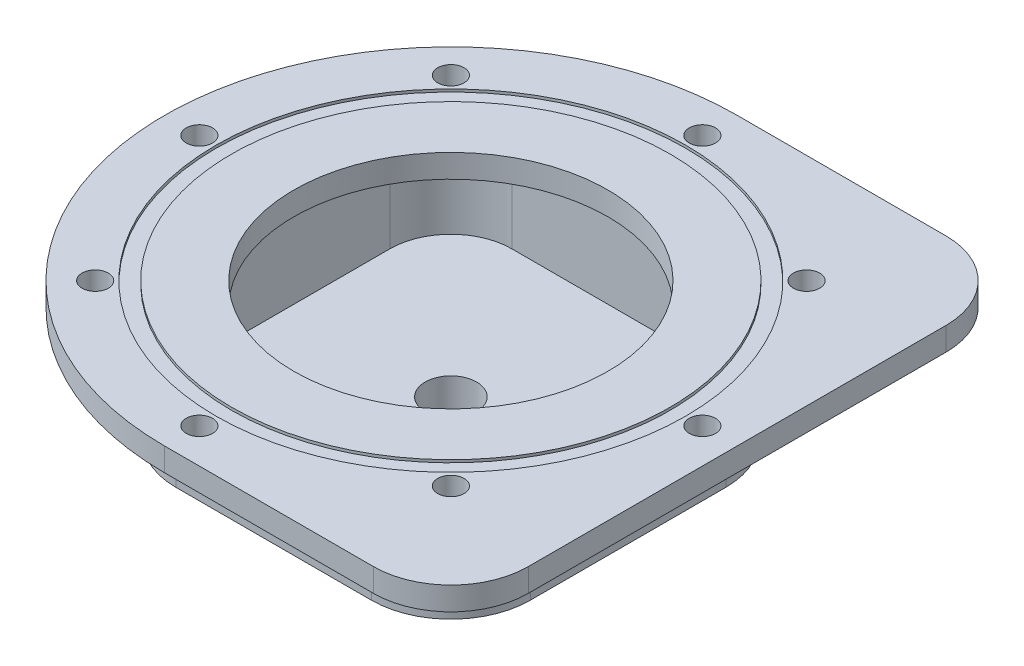
from build123d import *

# Parameters (mm, degrees)
SKETCH2_R           = 2.159
BOSS_EXTRUDE3_DEPTH = 3.81
SKETCH1_R           = 38.5318
SKETCH1_R_2         = 35.9918
CUT_EXTRUDE1_DEPTH  = 0.4445
SKETCH4_R           = 25.781
CUT_EXTRUDE2_DEPTH  = 3.81
BOSS_EXTRUDE4_DEPTH = 12.7
BOSS_EXTRUDE5_DEPTH = 6.35
CUT_EXTRUDE3_START  = -3.81
CUT_EXTRUDE3_DEPTH  = 3.81
BOSS_EXTRUDE6_DEPTH = 15.875
CUT_EXTRUDE4_REACH  = 72.276
SKETCH12_R          = 4.2164


with BuildPart() as part:
    # Sketch2 → Boss-Extrude3 (new body)
    with BuildSketch(Plane(origin=(0, 0, 0), x_dir=(1, 0, 0), z_dir=(0, 1, 0))):
        with BuildLine():
            Line((34.29, 46.99), (-34.29, 46.99))
            ThreePointArc((-34.29, 46.99), (-43.270256121, 43.270256121), (-46.99, 34.29))
            Line((-46.99, 34.29), (-46.99, -34.29))
            ThreePointArc((-46.99, -34.29), (-43.270256121, -43.270256121), (-34.29, -46.99))
            Line((-34.29, -46.99), (34.29, -46.99))
            ThreePointArc((34.29, -46.99), (43.270256121, -43.270256121), (46.99, -34.29))
            Line((46.99, -34.29), (46.99, 34.29))
            ThreePointArc((46.99, 34.29), (43.270256121, 43.270256121), (34.29, 46.99))
        make_face()
        with Locations(Location((0, 41.275, 0), (0, 0, 270))):
            Circle(SKETCH2_R, mode=Mode.SUBTRACT)
        with Locations(Location((29.185832393, 29.185832393, 0), (0, 0, 270))):
            Circle(SKETCH2_R, mode=Mode.SUBTRACT)
        with Locations(Location((41.275, 0, 0), (0, 0, 270))):
            Circle(SKETCH2_R, mode=Mode.SUBTRACT)
        with Locations(Location((29.185832393, -29.185832393, 0), (0, 0, 270))):
            Circle(SKETCH2_R, mode=Mode.SUBTRACT)
        with Locations(Location((0, -41.275, 0), (0, 0, 270))):
            Circle(SKETCH2_R, mode=Mode.SUBTRACT)
        with Locations(Location((-29.185832393, -29.185832393, 0), (0, 0, 270))):
            Circle(SKETCH2_R, mode=Mode.SUBTRACT)
        with Locations(Location((-41.275, 0, 0), (0, 0, 270))):
            Circle(SKETCH2_R, mode=Mode.SUBTRACT)
        with Locations(Location((-29.185832393, 29.185832393, 0), (0, 0, 270))):
            Circle(SKETCH2_R, mode=Mode.SUBTRACT)
    extrude(amount=-BOSS_EXTRUDE3_DEPTH)

    # Sketch1 → Cut-Extrude1 (cut)
    with BuildSketch(Plane(origin=(0, 0, 0), x_dir=(1, 0, 0), z_dir=(0, 1, 0))):
        with Locations(Location((0, 0, 0), (0, 0, 270))):
            Circle(SKETCH1_R)
        with Locations(Location((0, 0, 0), (0, 0, 270))):
            Circle(SKETCH1_R_2, mode=Mode.SUBTRACT)
    extrude(amount=-CUT_EXTRUDE1_DEPTH, mode=Mode.SUBTRACT)

    # Sketch4 → Cut-Extrude2 (cut)
    with BuildSketch(Plane(origin=(0, 0, 0), x_dir=(1, 0, 0), z_dir=(0, 1, 0))):
        with Locations(Location((0, 0, 0), (0, 0, 270))):
            Circle(SKETCH4_R)
    extrude(amount=-CUT_EXTRUDE2_DEPTH, mode=Mode.SUBTRACT)

    # Sketch5 → Boss-Extrude4 (add)
    with BuildSketch(Plane.XZ.offset(3.81)):
        with BuildLine():
            ThreePointArc((-29.083, 16.035), (-25.261329281, 25.261329281), (-16.035, 29.083))
            Line((-16.035, 29.083), (16.035, 29.083))
            ThreePointArc((16.035, 29.083), (25.261329281, 25.261329281), (29.083, 16.035))
            Line((29.083, 16.035), (29.083, -16.035))
            ThreePointArc((29.083, -16.035), (25.261329281, -25.261329281), (16.035, -29.083))
            Line((16.035, -29.083), (-16.035, -29.083))
            ThreePointArc((-16.035, -29.083), (-25.261329281, -25.261329281), (-29.083, -16.035))
            Line((-29.083, -16.035), (-29.083, 16.035))
        make_face()
        with BuildLine():
            Line((-26.035, -16.035), (-26.035, 16.035))
            ThreePointArc((-26.035, 16.035), (-23.106067812, 23.106067812), (-16.035, 26.035))
            Line((-16.035, 26.035), (16.035, 26.035))
            ThreePointArc((16.035, 26.035), (23.106067812, 23.106067812), (26.035, 16.035))
            Line((26.035, 16.035), (26.035, -16.035))
            ThreePointArc((26.035, -16.035), (23.106067812, -23.106067812), (16.035, -26.035))
            Line((16.035, -26.035), (-16.035, -26.035))
            ThreePointArc((-16.035, -26.035), (-23.106067812, -23.106067812), (-26.035, -16.035))
        make_face(mode=Mode.SUBTRACT)
    extrude(amount=BOSS_EXTRUDE4_DEPTH)

    # Sketch6 → Boss-Extrude5 (add)
    with BuildSketch(Plane.XZ.offset(16.51)):
        with BuildLine():
            Line((-29.083, 16.035), (-29.083, -16.035))
            ThreePointArc((-29.083, -16.035), (-25.261329281, -25.261329281), (-16.035, -29.083))
            Line((-16.035, -29.083), (16.035, -29.083))
            ThreePointArc((16.035, -29.083), (25.261329281, -25.261329281), (29.083, -16.035))
            Line((29.083, -16.035), (29.083, 16.035))
            ThreePointArc((29.083, 16.035), (25.261329281, 25.261329281), (16.035, 29.083))
            Line((16.035, 29.083), (-16.035, 29.083))
            ThreePointArc((-16.035, 29.083), (-25.261329281, 25.261329281), (-29.083, 16.035))
        make_face()
    extrude(amount=BOSS_EXTRUDE5_DEPTH)

    # Sketch7 → Cut-Extrude3 (cut)
    with BuildSketch(Plane.XZ.offset(3.81).offset(CUT_EXTRUDE3_START)):
        with BuildLine():
            Line((-46.99, 34.29), (-46.99, 0))
            ThreePointArc((-46.99, 0), (-33.226947648, 33.226947648), (0, 46.99))
            Line((0, 46.99), (-34.29, 46.99))
            ThreePointArc((-34.29, 46.99), (-43.270256121, 43.270256121), (-46.99, 34.29))
        make_face()
        with BuildLine():
            ThreePointArc((0, -46.99), (-33.226947648, -33.226947648), (-46.99, 0))
            Line((-46.99, 0), (-46.99, -34.29))
            ThreePointArc((-46.99, -34.29), (-43.270256121, -43.270256121), (-34.29, -46.99))
            Line((-34.29, -46.99), (0, -46.99))
        make_face()
    extrude(amount=CUT_EXTRUDE3_DEPTH, mode=Mode.SUBTRACT)

    # Sketch8 → Boss-Extrude6 (add, symmetric)
    with BuildSketch(Plane(origin=(0, 0, 0), x_dir=(0, 0, -1), z_dir=(1, 0, 0))):
        Polygon((-29.083, -3.81), (-29.083, -11.43), (-34.163, -3.81), align=None)
    boss_extrude6 = extrude(amount=BOSS_EXTRUDE6_DEPTH, both=True)

    # Mirror1: Boss-Extrude6 across plane
    add(boss_extrude6.mirror(Plane.XY))

    # Sketch12 → Cut-Extrude4 (cut, up to next)
    with BuildSketch(Plane.XZ.offset(22.86), mode=Mode.PRIVATE) as cut_extrude4_sk1:
        with Locations(Location((-16.035, 16.035, 0), (0, 0, 270))):
            Circle(SKETCH12_R)
    cut_extrude4_tool1 = extrude(cut_extrude4_sk1.sketch, amount=-CUT_EXTRUDE4_REACH, mode=Mode.PRIVATE) & part.part
    # Sketch12 → Cut-Extrude4 (cut, up to next)
    with BuildSketch(Plane.XZ.offset(22.86), mode=Mode.PRIVATE) as cut_extrude4_sk2:
        with Locations(Location((16.035, -16.035, 0), (0, 0, 270))):
            Circle(SKETCH12_R)
    cut_extrude4_tool2 = extrude(cut_extrude4_sk2.sketch, amount=-CUT_EXTRUDE4_REACH, mode=Mode.PRIVATE) & part.part
    # Sketch12 → Cut-Extrude4 (cut, up to next)
    with BuildSketch(Plane.XZ.offset(22.86), mode=Mode.PRIVATE) as cut_extrude4_sk3:
        with Locations(Location((0, 0, 0), (0, 0, 270))):
            Circle(SKETCH12_R)
    cut_extrude4_tool3 = extrude(cut_extrude4_sk3.sketch, amount=-CUT_EXTRUDE4_REACH, mode=Mode.PRIVATE) & part.part
    add(cut_extrude4_tool1.solids().sort_by_distance((-16.035, -22.86, 16.035))[0], mode=Mode.SUBTRACT)
    add(cut_extrude4_tool2.solids().sort_by_distance((16.035, -22.86, -16.035))[0], mode=Mode.SUBTRACT)
    add(cut_extrude4_tool3.solids().sort_by_distance((0, -22.86, 0))[0], mode=Mode.SUBTRACT)


solid = part.part
